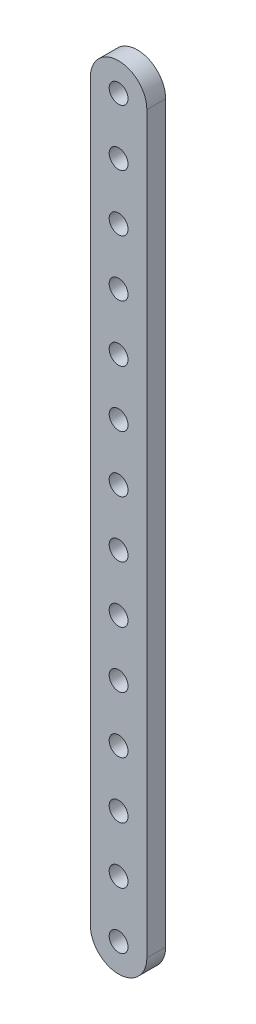
from build123d import *

# Parameters (mm, degrees)
MODEL_R                 = 1.5
SALIENTE_EXTRUIR1_DEPTH = 3


with BuildPart() as part:
    # Model → Saliente-Extruir1 (new body)
    with BuildSketch(Plane.XY):
        with BuildLine():
            Line((213.25077615, 71.428489513), (213.25077615, 188.428489513))
            ThreePointArc((213.25077615, 188.428489513), (208.75077615, 192.928489513), (204.25077615, 188.428489513))
            Line((204.25077615, 188.428489513), (204.25077615, 71.428489513))
            ThreePointArc((204.25077615, 71.428489513), (208.75077615, 66.928489513), (213.25077615, 71.428489513))
        make_face()
        with Locations((208.75077615, 179.428489513)):
            Circle(MODEL_R, mode=Mode.SUBTRACT)
        with Locations((208.75077615, 188.428489513)):
            Circle(MODEL_R, mode=Mode.SUBTRACT)
        with Locations((208.75077615, 152.428489513)):
            Circle(MODEL_R, mode=Mode.SUBTRACT)
        with Locations((208.75077615, 161.428489513)):
            Circle(MODEL_R, mode=Mode.SUBTRACT)
        with Locations((208.75077615, 170.428489513)):
            Circle(MODEL_R, mode=Mode.SUBTRACT)
        with Locations((208.75077615, 143.428489513)):
            Circle(MODEL_R, mode=Mode.SUBTRACT)
        with Locations((208.75077615, 116.428489513)):
            Circle(MODEL_R, mode=Mode.SUBTRACT)
        with Locations((208.75077615, 125.428489513)):
            Circle(MODEL_R, mode=Mode.SUBTRACT)
        with Locations((208.75077615, 134.428489513)):
            Circle(MODEL_R, mode=Mode.SUBTRACT)
        with Locations((208.75077615, 71.428489513)):
            Circle(MODEL_R, mode=Mode.SUBTRACT)
        with Locations((208.75077615, 80.428489513)):
            Circle(MODEL_R, mode=Mode.SUBTRACT)
        with Locations((208.75077615, 89.428489513)):
            Circle(MODEL_R, mode=Mode.SUBTRACT)
        with Locations((208.75077615, 98.428489513)):
            Circle(MODEL_R, mode=Mode.SUBTRACT)
        with Locations((208.75077615, 107.428489513)):
            Circle(MODEL_R, mode=Mode.SUBTRACT)
    extrude(amount=SALIENTE_EXTRUIR1_DEPTH)


solid = part.part
